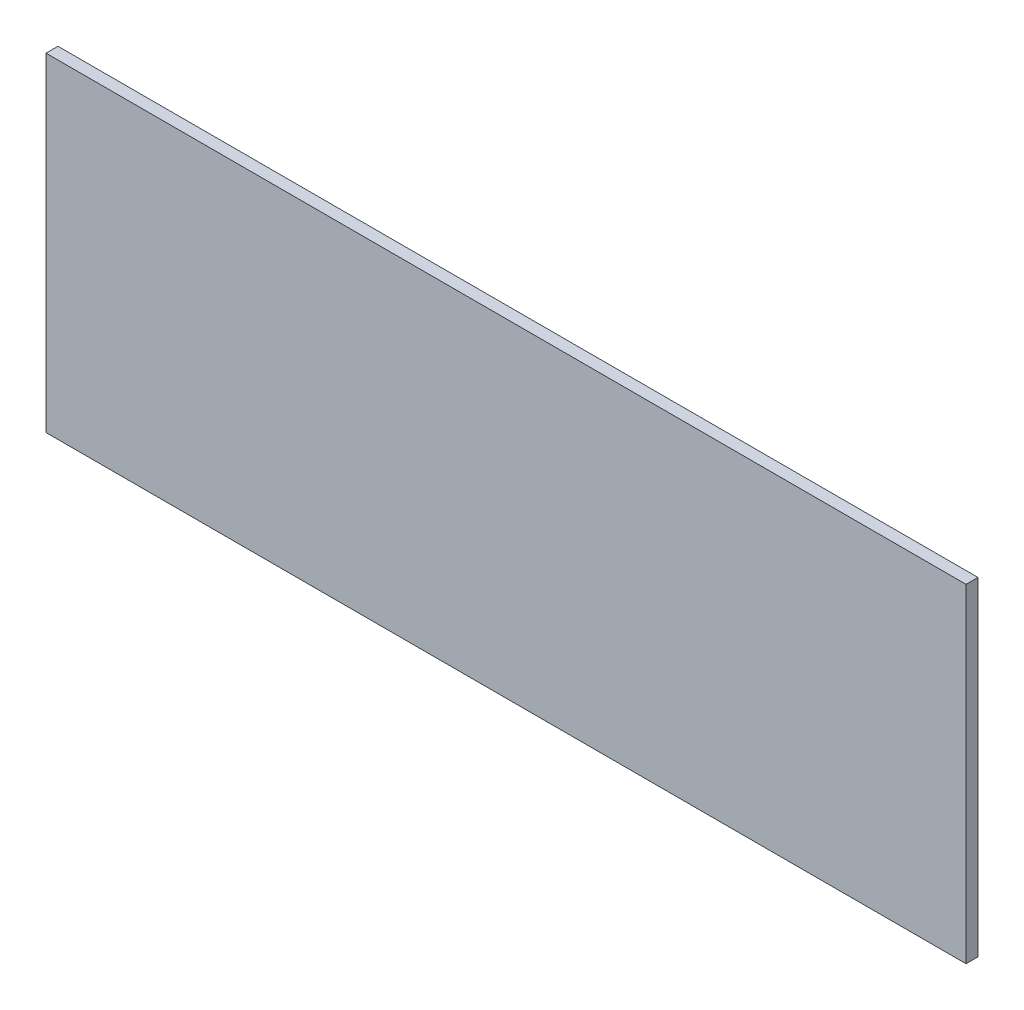
from build123d import *

# Parameters (mm, degrees)
SKETCH1_W     = 154
SKETCH1_H     = 55
PROFILE_DEPTH = 2


with BuildPart() as part:
    # Sketch1 → Profile (new body)
    with BuildSketch(Plane.XY):
        with Locations((77, 27.5)):
            Rectangle(SKETCH1_W, SKETCH1_H)
    extrude(amount=PROFILE_DEPTH)


solid = part.part
